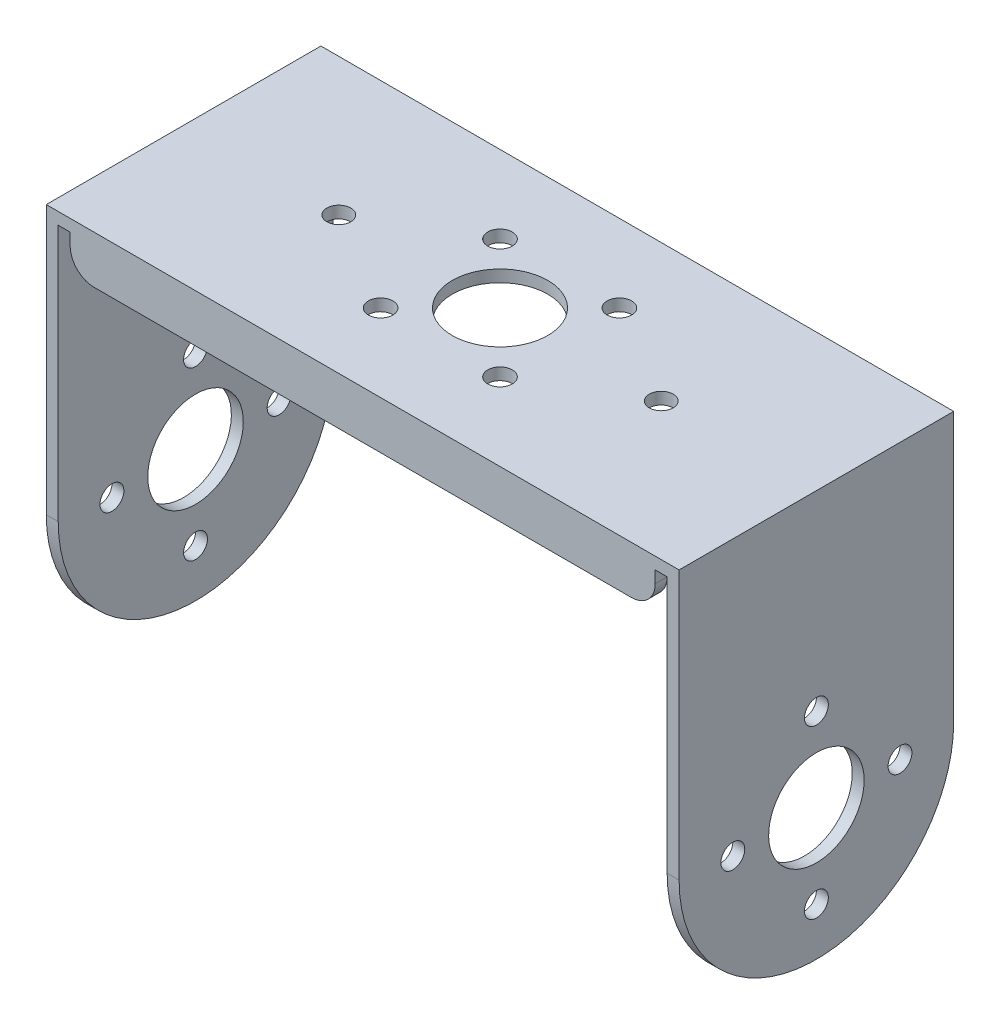
from build123d import *

# Parameters (mm, degrees)
EXTRUDE_1_DEPTH        = 21
CUT_EXTRUDE_1_REACH    = 67.376
CUT_EXTRUDE_2_REACH    = 67.376
SKETCH_3_R             = 4
SKETCH_3_R_2           = 1
SKETCH_4_R             = 4
SKETCH_4_R_2           = 1.026612686
SKETCH_4_R_3           = 1
CUT_EXTRUDE_3_DEPTH    = 1
SKETCH_6_W             = 49
SKETCH_6_H             = 1
EXTRUDE_2_DEPTH        = 1
SKETCH_7_W             = 49
SKETCH_7_H             = 1
EXTRUDE_3_DEPTH        = 3
FILLET_1_R             = 2
FILLET_1_OF_MIRROR_3_R = 2
EXTRUDE_START          = -1
EXTRUDE_4_DEPTH        = 1
SKETCH_10_W            = 1
SKETCH_10_H            = 1
EXTRUDE_5_DEPTH        = 1


with BuildPart() as part:
    # 草图1 → 凸台-拉伸1 (new body)
    with BuildSketch(Plane.XY):
        Polygon((-26.5, 1), (-26.5, -32), (-25.5, -32), (-25.5, 0), (25.5, 0), (25.5, -32), (26.5, -32), (26.5, 1), align=None)
    extrude(amount=EXTRUDE_1_DEPTH)

    # 切除-拉伸1: up to this face of the body (flat: up to its plane)
    cut_extrude_1_end = Plane(part.part.faces().sort_by_distance((26.5, -15.5, 10.5))[0])
    # 草图2 → 切除-拉伸1 (cut, up to the picked face)
    with BuildSketch(Plane.ZY.offset(26.5), mode=Mode.PRIVATE) as cut_extrude_1_sk1:
        with BuildLine():
            Line((0, -32), (10.5, -32))
            ThreePointArc((10.5, -32), (3.075378798, -28.924621202), (0, -21.5))
            Line((0, -21.5), (0, -32))
        make_face()
    cut_extrude_1_tool1 = split(extrude(cut_extrude_1_sk1.sketch, amount=-CUT_EXTRUDE_1_REACH, mode=Mode.PRIVATE), bisect_by=cut_extrude_1_end, keep=Keep.BOTH, mode=Mode.PRIVATE)
    cut_extrude_1 = cut_extrude_1_tool1.solids().sort_by(Axis((-26.5, -29.654637, 2.345363), (1, 0, 0)))[0]
    add(cut_extrude_1, mode=Mode.SUBTRACT)

    # 镜向1: 切除-拉伸1 across plane
    add(cut_extrude_1.mirror(Plane.XY.offset(10.5)), mode=Mode.SUBTRACT)

    # 切除-拉伸2: up to this face of the body (flat: up to its plane)
    cut_extrude_2_end = Plane(part.part.faces().sort_by_distance((-26.5, -14.462654994, 10.5))[0])
    # 草图3 → 切除-拉伸2 (cut, up to the picked face)
    with BuildSketch(Plane(origin=(26.5, 0, 0), x_dir=(0, 0, -1), z_dir=(1, 0, 0)), mode=Mode.PRIVATE) as cut_extrude_2_sk1:
        with Locations(Location((-10.5, -22, 0), (0, 0, 90))):
            Circle(SKETCH_3_R)
    cut_extrude_2_tool1 = split(extrude(cut_extrude_2_sk1.sketch, amount=-CUT_EXTRUDE_2_REACH, mode=Mode.PRIVATE), bisect_by=cut_extrude_2_end, keep=Keep.BOTH, mode=Mode.PRIVATE)
    # 草图3 → 切除-拉伸2 (cut, up to the picked face)
    with BuildSketch(Plane(origin=(26.5, 0, 0), x_dir=(0, 0, -1), z_dir=(1, 0, 0)), mode=Mode.PRIVATE) as cut_extrude_2_sk2:
        with Locations(Location((-3.5, -22, 0), (0, 0, 90))):
            Circle(SKETCH_3_R_2)
    cut_extrude_2_tool2 = split(extrude(cut_extrude_2_sk2.sketch, amount=-CUT_EXTRUDE_2_REACH, mode=Mode.PRIVATE), bisect_by=cut_extrude_2_end, keep=Keep.BOTH, mode=Mode.PRIVATE)
    # 草图3 → 切除-拉伸2 (cut, up to the picked face)
    with BuildSketch(Plane(origin=(26.5, 0, 0), x_dir=(0, 0, -1), z_dir=(1, 0, 0)), mode=Mode.PRIVATE) as cut_extrude_2_sk3:
        with Locations(Location((-10.5, -15, 0), (0, 0, 90))):
            Circle(SKETCH_3_R_2)
    cut_extrude_2_tool3 = split(extrude(cut_extrude_2_sk3.sketch, amount=-CUT_EXTRUDE_2_REACH, mode=Mode.PRIVATE), bisect_by=cut_extrude_2_end, keep=Keep.BOTH, mode=Mode.PRIVATE)
    # 草图3 → 切除-拉伸2 (cut, up to the picked face)
    with BuildSketch(Plane(origin=(26.5, 0, 0), x_dir=(0, 0, -1), z_dir=(1, 0, 0)), mode=Mode.PRIVATE) as cut_extrude_2_sk4:
        with Locations(Location((-17.5, -22, 0), (0, 0, 90))):
            Circle(SKETCH_3_R_2)
    cut_extrude_2_tool4 = split(extrude(cut_extrude_2_sk4.sketch, amount=-CUT_EXTRUDE_2_REACH, mode=Mode.PRIVATE), bisect_by=cut_extrude_2_end, keep=Keep.BOTH, mode=Mode.PRIVATE)
    # 草图3 → 切除-拉伸2 (cut, up to the picked face)
    with BuildSketch(Plane(origin=(26.5, 0, 0), x_dir=(0, 0, -1), z_dir=(1, 0, 0)), mode=Mode.PRIVATE) as cut_extrude_2_sk5:
        with Locations(Location((-10.5, -29, 0), (0, 0, 90))):
            Circle(SKETCH_3_R_2)
    cut_extrude_2_tool5 = split(extrude(cut_extrude_2_sk5.sketch, amount=-CUT_EXTRUDE_2_REACH, mode=Mode.PRIVATE), bisect_by=cut_extrude_2_end, keep=Keep.BOTH, mode=Mode.PRIVATE)
    add(cut_extrude_2_tool1.solids().sort_by(Axis((26.5, -22, 10.5), (-1, 0, 0)))[0], mode=Mode.SUBTRACT)
    add(cut_extrude_2_tool2.solids().sort_by(Axis((26.5, -22, 3.5), (-1, 0, 0)))[0], mode=Mode.SUBTRACT)
    add(cut_extrude_2_tool3.solids().sort_by(Axis((26.5, -15, 10.5), (-1, 0, 0)))[0], mode=Mode.SUBTRACT)
    add(cut_extrude_2_tool4.solids().sort_by(Axis((26.5, -22, 17.5), (-1, 0, 0)))[0], mode=Mode.SUBTRACT)
    add(cut_extrude_2_tool5.solids().sort_by(Axis((26.5, -29, 10.5), (-1, 0, 0)))[0], mode=Mode.SUBTRACT)

    # 草图4 → 切除-拉伸3 (cut)
    with BuildSketch(Plane(origin=(0, 1, 0), x_dir=(1, 0, 0), z_dir=(0, 1, 0))):
        with Locations(Location((0, -10.5, 0), (0, 0, 180))):
            Circle(SKETCH_4_R)
        with Locations(Location((5, -5.5, 0), (0, 0, 180))):
            Circle(SKETCH_4_R_2)
        with Locations(Location((13.5, -10.5, 0), (0, 0, 180))):
            Circle(SKETCH_4_R_3)
        with Locations(Location((-13.5, -10.5, 0), (0, 0, 180))):
            Circle(SKETCH_4_R_3)
        with Locations((5, -15.5)):
            Circle(SKETCH_4_R_2)
        with Locations((-5, -5.5)):
            Circle(SKETCH_4_R_2)
        with Locations(Location((-5, -15.5, 0), (0, 0, 180))):
            Circle(SKETCH_4_R_2)
    extrude(amount=-CUT_EXTRUDE_3_DEPTH, mode=Mode.SUBTRACT)

    # 草图6 → 凸台-拉伸2 (add)
    with BuildSketch(Plane.XY.offset(21)):
        with Locations((0, 0.5)):
            Rectangle(SKETCH_6_W, SKETCH_6_H)
    extrude_2 = extrude(amount=EXTRUDE_2_DEPTH)

    # 草图7 → 凸台-拉伸3 (add)
    with BuildSketch(Plane.XZ):
        with Locations((0, 21.5)):
            Rectangle(SKETCH_7_W, SKETCH_7_H)
    extrude_3 = extrude(amount=EXTRUDE_3_DEPTH)

    # 圆角1
    fillet_1_edges = [part.edges().sort_by_distance(p)[0] for p in [
        (24.5, -3, 21.5),
        (-24.5, -3, 21.5),
    ]]
    fillet(fillet_1_edges, radius=FILLET_1_R)

    # 镜向3: 凸台-拉伸2, 凸台-拉伸3 across plane
    add(extrude_2.mirror(Plane.XY.offset(10.5)))
    add(extrude_3.mirror(Plane.XY.offset(10.5)))

    # 圆角1 of 镜向3
    fillet_1_of_mirror_3_edges = [part.edges().sort_by_distance(p)[0] for p in [
        (24.5, -3, -0.5),
        (-24.5, -3, -0.5),
    ]]
    fillet(fillet_1_of_mirror_3_edges, radius=FILLET_1_OF_MIRROR_3_R)

    # 草图9 → 凸台-拉伸4 (add)
    with BuildSketch(Plane(origin=(26.5, 0, 0), x_dir=(0, 0, -1), z_dir=(1, 0, 0)).offset(EXTRUDE_START)):
        with BuildLine():
            Line((-21, 1), (-22, 1))
            Line((-22, 1), (-22, -21.5))
            ThreePointArc((-22, -21.5), (-10.5, -33), (1, -21.5))
            Line((1, -21.5), (1, 1))
            Line((1, 1), (0, 1))
            Line((0, 1), (0, -21.5))
            ThreePointArc((0, -21.5), (-10.5, -32), (-21, -21.5))
            Line((-21, -21.5), (-21, 1))
        make_face()
    extrude_4 = extrude(amount=EXTRUDE_4_DEPTH)

    # 镜向4: 凸台-拉伸4 across plane
    add(extrude_4.mirror(Plane(origin=(0, 0, 0), x_dir=(0, 0, 1), z_dir=(1, 0, 0))))

    # 草图10 → 凸台-拉伸5 (add)
    with BuildSketch(Plane(origin=(0, 1, 0), x_dir=(1, 0, 0), z_dir=(0, 1, 0))):
        with Locations((-25, 0.5)):
            Rectangle(SKETCH_10_W, SKETCH_10_H)
        with Locations((-25, -21.5)):
            Rectangle(SKETCH_10_W, SKETCH_10_H)
        with Locations((25, 0.5)):
            Rectangle(SKETCH_10_W, SKETCH_10_H)
        with Locations((25, -21.5)):
            Rectangle(SKETCH_10_W, SKETCH_10_H)
    extrude(amount=-EXTRUDE_5_DEPTH)


solid = part.part
